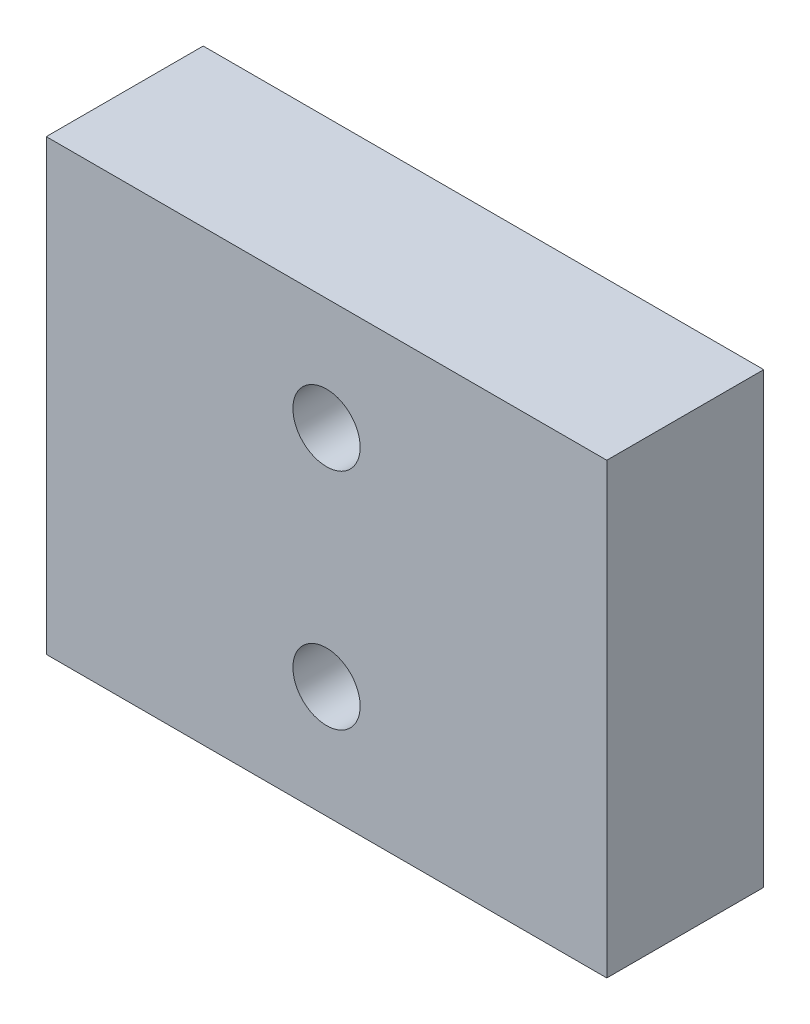
from build123d import *

# Parameters (mm, degrees)
ESQUISSE1_W             = 25
ESQUISSE1_H             = 20
BOSS_EXTRU_1_DEPTH      = 7
ESQUISSE2_R             = 1.5
ENL_V_MAT_EXTRU_1_DEPTH = 3


with BuildPart() as part:
    # Esquisse1 → Boss.-Extru.1 (new body)
    with BuildSketch(Plane.XY):
        with Locations((12.5, 10)):
            Rectangle(ESQUISSE1_W, ESQUISSE1_H)
    extrude(amount=BOSS_EXTRU_1_DEPTH)

    # Esquisse2 → Enlèv. mat.-Extru.1 (cut)
    with BuildSketch(Plane.XY.offset(7)):
        with Locations((12.5, 15)):
            Circle(ESQUISSE2_R)
        with Locations((12.5, 5)):
            Circle(ESQUISSE2_R)
    extrude(amount=-ENL_V_MAT_EXTRU_1_DEPTH, mode=Mode.SUBTRACT)


solid = part.part
